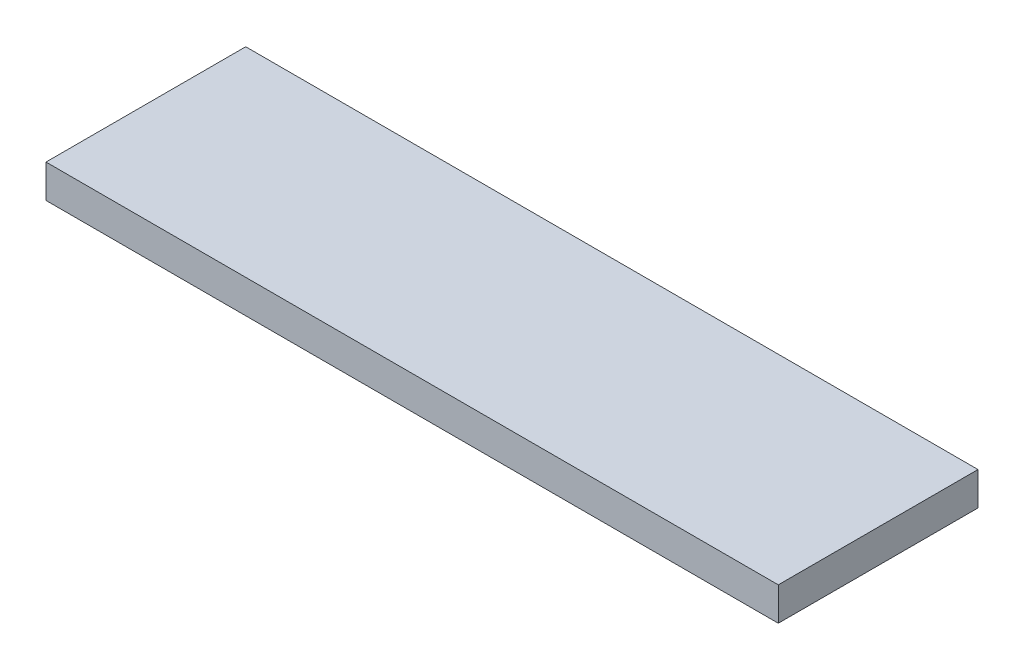
from build123d import *

# Parameters (mm, degrees)
SKETCH1_W           = 1100
SKETCH1_H           = 300
BOSS_EXTRUDE1_DEPTH = 50


with BuildPart() as part:
    # Sketch1 → Boss-Extrude1 (new body)
    with BuildSketch(Plane(origin=(0, 0, 0), x_dir=(1, 0, 0), z_dir=(0, 1, 0))):
        Rectangle(SKETCH1_W, SKETCH1_H)
    extrude(amount=BOSS_EXTRUDE1_DEPTH)


solid = part.part
